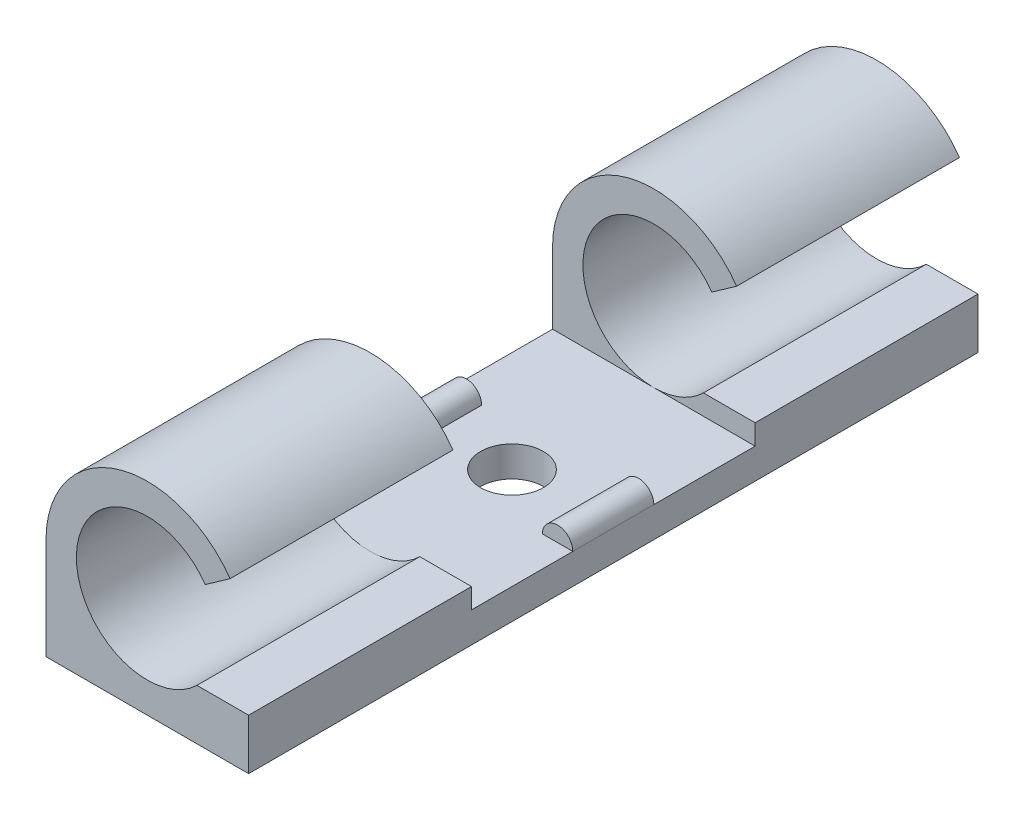
from build123d import *

# Parameters (mm, degrees)
RESSALTO_EXTRUS_O1_DEPTH = 11
ESBO_O2_W                = 10
ESBO_O2_H                = 1.5
RESSALTO_EXTRUS_O2_DEPTH = 7
RESSALTO_EXTRUS_O3_DEPTH = 2
ESBO_O4_R                = 1.55
CORTE_EXTRUS_O1_DEPTH    = 2
CORTE_EXTRUS_O2_DEPTH    = 37.687872656


with BuildPart() as part:
    # Esboço1 → Ressalto-extrusão1 (new body)
    with BuildSketch(Plane.XY):
        with BuildLine():
            Line((-5, -5), (0, -5))
            ThreePointArc((0, -5), (-3.535533906, -3.535533906), (-5, 0))
            Line((-5, 0), (-5, -5))
        make_face()
        with BuildLine():
            Line((5, -5), (5, 0))
            ThreePointArc((5, 0), (3.535533906, -3.535533906), (0, -5))
            Line((0, -5), (5, -5))
        make_face()
        with BuildLine():
            ThreePointArc((-3.5, 0), (0, 3.5), (3.5, 0))
            Line((3.5, 0), (5, 0))
            ThreePointArc((5, 0), (3.535533906, 3.535533905), (1e-09, 5))
            ThreePointArc((1e-09, 5), (-3.535533905, 3.535533906), (-5, 0))
            Line((-5, 0), (-3.5, 0))
        make_face()
        with BuildLine():
            Line((5, 0), (3.5, 0))
            ThreePointArc((3.5, 0), (0, -3.5), (-3.5, 0))
            Line((-3.5, 0), (-5, 0))
            ThreePointArc((-5, 0), (-3.535533906, -3.535533906), (0, -5))
            ThreePointArc((0, -5), (3.535533906, -3.535533906), (5, 0))
        make_face()
    ressalto_extrus_o1 = extrude(amount=RESSALTO_EXTRUS_O1_DEPTH)

    # Esboço2 → Ressalto-extrusão2 (add)
    with BuildSketch(Plane.XY.offset(11)):
        with Locations((0, -4.25)):
            Rectangle(ESBO_O2_W, ESBO_O2_H)
    ressalto_extrus_o2 = extrude(amount=RESSALTO_EXTRUS_O2_DEPTH)

    # Esboço3 → Ressalto-extrusão3 (add)
    with BuildSketch(Plane.XY.offset(18)):
        with BuildLine():
            Line((3.5, -3.5), (5, -3.5))
            ThreePointArc((5, -3.5), (4.25, -2.75), (3.5, -3.5))
        make_face()
        with BuildLine():
            Line((-5, -3.5), (-3.5, -3.5))
            ThreePointArc((-3.5, -3.5), (-4.25, -2.75), (-5, -3.5))
        make_face()
    ressalto_extrus_o3 = extrude(amount=-RESSALTO_EXTRUS_O3_DEPTH)

    # Espelhar1: Ressalto-extrusão1, Ressalto-extrusão2, Ressalto-extrusão3 across plane
    add(ressalto_extrus_o1.mirror(Plane(origin=(0, 0, 18), x_dir=(1, 0, 0), z_dir=(0, 0, -1))))
    add(ressalto_extrus_o2.mirror(Plane(origin=(0, 0, 18), x_dir=(1, 0, 0), z_dir=(0, 0, -1))))
    add(ressalto_extrus_o3.mirror(Plane(origin=(0, 0, 18), x_dir=(1, 0, 0), z_dir=(0, 0, -1))))

    # Esboço4 → Corte-extrusão1 (cut)
    with BuildSketch(Plane(origin=(0, -3.5, 0), x_dir=(1, 0, 0), z_dir=(0, 1, 0))):
        with Locations(Location((0, -18, 0), (0, 0, 270))):
            Circle(ESBO_O4_R)
    extrude(amount=-CORTE_EXTRUS_O1_DEPTH, mode=Mode.SUBTRACT)

    # Esboço5 → Corte-extrusão2 (cut, through all)
    with BuildSketch(Plane.XY.offset(36)):
        with BuildLine():
            Line((2.449489743, -2.5), (5, -2.5))
            Line((5, -2.5), (5, 0))
            ThreePointArc((5, 0), (4.766431527, 1.510341187), (4.087547799, 2.87957514))
            Line((4.087547799, 2.87957514), (2.861283459, 2.015702598))
            ThreePointArc((2.861283459, 2.015702598), (3.336502069, 1.057238831), (3.5, 0))
            ThreePointArc((3.5, 0), (3.226702194, -1.355873501), (2.449489743, -2.5))
        make_face()
    extrude(amount=-CORTE_EXTRUS_O2_DEPTH, mode=Mode.SUBTRACT)


solid = part.part
